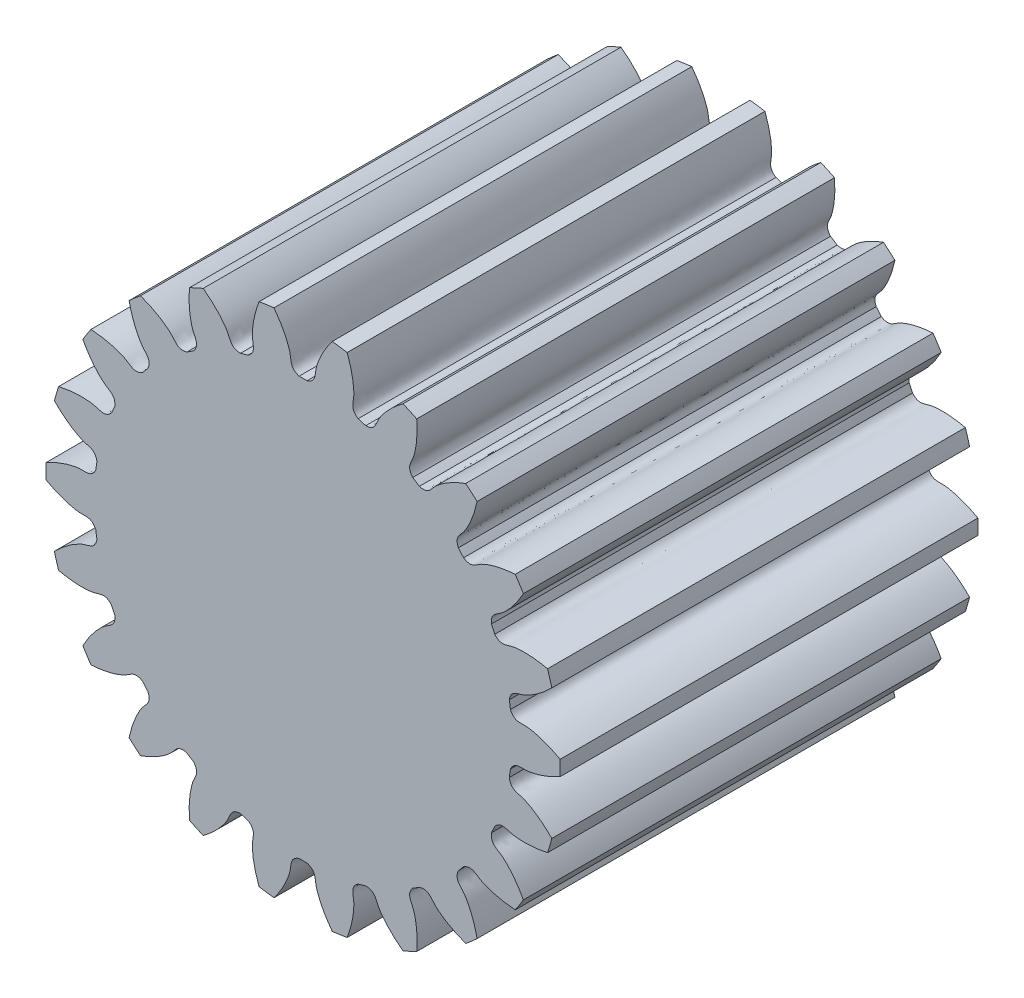
from build123d import *

# Parameters (mm, degrees)
SKETCH_1_R               = 12
EXTRUDE_1_DEPTH          = 30
CUT_EXTRUDE_1_DEPTH      = 35.467375879
PATTERN_CIRCULAR_1_COUNT = 22
SKETCH_4_R               = 17.786555929
CUT_EXTRUDE_2_DEPTH      = 10.5


with BuildPart() as part:
    # 草图1 → 凸台-拉伸1 (new body)
    with BuildSketch(Plane.XY):
        Circle(SKETCH_1_R)
    extrude(amount=EXTRUDE_1_DEPTH)

    # 草图2 → 切除-拉伸1 (cut, through all)
    with BuildSketch(Plane.XY):
        with BuildLine():
            ThreePointArc((0.185665431, 9.748232063), (0, 9.75), (-0.185665431, 9.748232063))
            add(Edge.make_bspline(
                [(-0.185665431, 9.748232063), (-0.588158706, 9.876186429), (-0.548347264, 10.151774696), (-0.599584047, 10.42157039), (-0.60596118, 10.451918903), (-0.613876897, 10.486162213), (-0.623483721, 10.524250431), (-0.634939934, 10.566127653), (-0.648399943, 10.611733662), (-0.664017171, 10.661003439), (-0.681942991, 10.713867378), (-0.70232689, 10.77025128), (-0.72531626, 10.830076418), (-0.751056303, 10.893259589), (-0.779689902, 10.959713172), (-0.811357505, 11.029345185), (-0.846197011, 11.10205935), (-0.884343649, 11.177755162), (-0.925929868, 11.25632795), (-0.971085225, 11.337668957), (-1.019936271, 11.421665408), (-1.072606448, 11.508200591), (-1.129215979, 11.597153935), (-1.189881763, 11.688401095), (-1.254717274, 11.781814033), (-1.323832459, 11.877261111), (-1.397333644, 11.974607178), (-1.475323431, 12.073713662), (-1.557900608, 12.174438668), (-1.64516006, 12.276637076), (-1.737192673, 12.380160638), (-1.834085256, 12.484858081), (-1.935920447, 12.590575215), (-2.042776642, 12.697155033), (-2.154727905, 12.804437827), (-2.271843904, 12.912261294), (-2.394189822, 13.020460649), (-2.521826308, 13.128868741), (-2.654809363, 13.237316171), (-2.841488127, 13.383435539), (-2.986445715, 13.489968103), (-3.085558798, 13.559868128)],
                knots=[0, 0, 0, 0, 0.157021319, 0.162530984, 0.168888289, 0.176093235, 0.184145822, 0.19304605, 0.202793918, 0.213389427, 0.224832576, 0.237123367, 0.250261798, 0.264247869, 0.279081582, 0.294762935, 0.311291928, 0.328668563, 0.346892838, 0.365964754, 0.38588431, 0.406651508, 0.428266346, 0.450728824, 0.474038944, 0.498196704, 0.523202104, 0.549055146, 0.575755828, 0.603304151, 0.631700114, 0.660943719, 0.691034964, 0.721973849, 0.753760376, 0.786394543, 0.819876351, 0.854205799, 0.889382888, 0.925407618, 1, 1, 1, 1], degree=3))
            ThreePointArc((-3.085558798, 13.559868128), (0, 13.906498364), (3.085558798, 13.559868128))
            add(Edge.make_bspline(
                [(0.185665431, 9.748232063), (0.588158706, 9.876186429), (0.548347264, 10.151774696), (0.599584047, 10.42157039), (0.60596118, 10.451918903), (0.613876897, 10.486162213), (0.623483721, 10.524250431), (0.634939934, 10.566127653), (0.648399943, 10.611733662), (0.664017171, 10.661003439), (0.681942991, 10.713867378), (0.70232689, 10.77025128), (0.72531626, 10.830076418), (0.751056303, 10.893259589), (0.779689902, 10.959713172), (0.811357505, 11.029345185), (0.846197011, 11.10205935), (0.884343649, 11.177755162), (0.925929868, 11.25632795), (0.971085225, 11.337668957), (1.019936271, 11.421665408), (1.072606448, 11.508200591), (1.129215979, 11.597153935), (1.189881763, 11.688401095), (1.254717274, 11.781814033), (1.323832459, 11.877261111), (1.397333644, 11.974607178), (1.475323431, 12.073713662), (1.557900608, 12.174438668), (1.64516006, 12.276637076), (1.737192673, 12.380160638), (1.834085256, 12.484858081), (1.935920447, 12.590575215), (2.042776642, 12.697155033), (2.154727905, 12.804437827), (2.271843904, 12.912261294), (2.394189822, 13.020460649), (2.521826308, 13.128868741), (2.654809363, 13.237316171), (2.841488127, 13.383435539), (2.986445715, 13.489968103), (3.085558798, 13.559868128)],
                knots=[0, 0, 0, 0, 0.157021319, 0.162530984, 0.168888289, 0.176093235, 0.184145822, 0.19304605, 0.202793918, 0.213389427, 0.224832576, 0.237123367, 0.250261798, 0.264247869, 0.279081582, 0.294762935, 0.311291928, 0.328668563, 0.346892838, 0.365964754, 0.38588431, 0.406651508, 0.428266346, 0.450728824, 0.474038944, 0.498196704, 0.523202104, 0.549055146, 0.575755828, 0.603304151, 0.631700114, 0.660943719, 0.691034964, 0.721973849, 0.753760376, 0.786394543, 0.819876351, 0.854205799, 0.889382888, 0.925407618, 1, 1, 1, 1], degree=3))
        make_face()
    cut_extrude_1 = extrude(amount=CUT_EXTRUDE_1_DEPTH, mode=Mode.SUBTRACT)

    # 阵列(圆周)1: 切除-拉伸1 ×22 about axis
    pattern_circular_1_axis = Axis((0, 0, -1.5), (0, 0, 1))
    for i in range(1, PATTERN_CIRCULAR_1_COUNT):
        add(cut_extrude_1.rotate(pattern_circular_1_axis, i * 360 / PATTERN_CIRCULAR_1_COUNT), mode=Mode.SUBTRACT)

    # 草图4 → 切除-拉伸2 (cut)
    with BuildSketch(Plane.XY.offset(30)):
        Circle(SKETCH_4_R)
    extrude(amount=-CUT_EXTRUDE_2_DEPTH, mode=Mode.SUBTRACT)


solid = part.part
